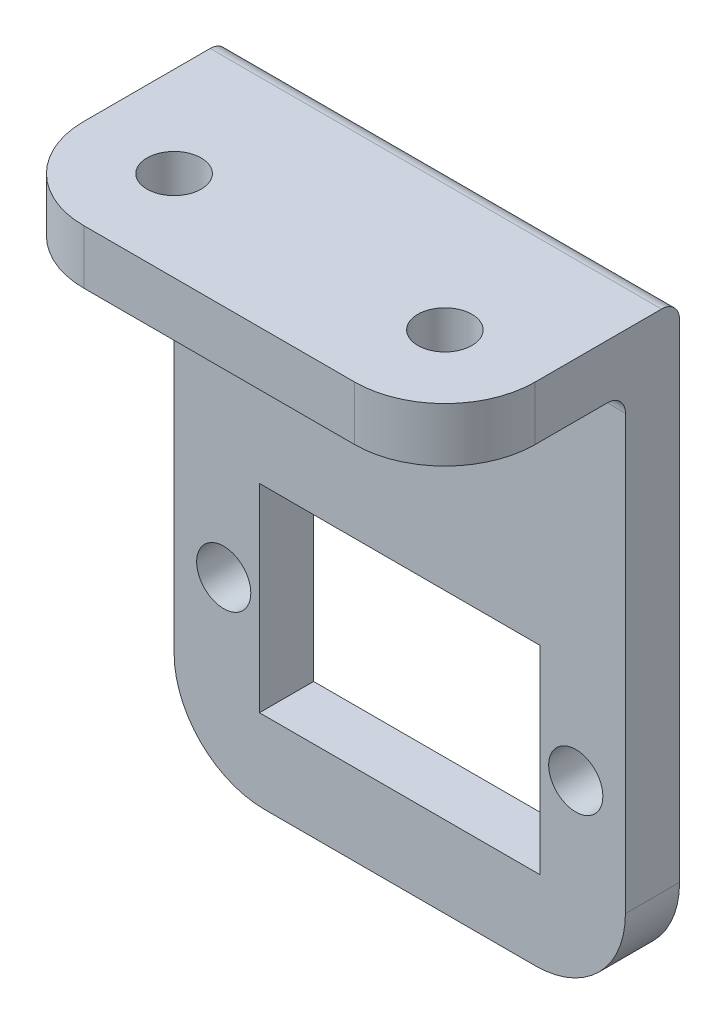
from build123d import *

# Parameters (mm, degrees)
SKETCH1_W           = 25
SKETCH1_H           = 30
SKETCH1_R           = 1.5
BOSS_EXTRUDE1_DEPTH = 3
SKETCH2_W           = 15.54
SKETCH2_H           = 11
CUT_EXTRUDE1_DEPTH  = 20.754746265
FILLET1_R           = 5
SKETCH4_W           = 25
SKETCH4_H           = 3
BOSS_EXTRUDE2_DEPTH = 3
SKETCH5_W           = 25
SKETCH5_H           = 3
BOSS_EXTRUDE3_DEPTH = 10
FILLET2_R           = 5
FILLET3_R           = 5
SKETCH7_R           = 1.5
CUT_EXTRUDE2_DEPTH  = 36.003571246
FILLET4_R           = 1
FILLET5_R           = 1


with BuildPart() as part:
    # Sketch1 → Boss-Extrude1 (new body)
    with BuildSketch(Plane.XY):
        Rectangle(SKETCH1_W, SKETCH1_H)
        with Locations((-9.75, -5)):
            Circle(SKETCH1_R, mode=Mode.SUBTRACT)
        with Locations((9.75, -5)):
            Circle(SKETCH1_R, mode=Mode.SUBTRACT)
    extrude(amount=BOSS_EXTRUDE1_DEPTH)

    # Sketch2 → Cut-Extrude1 (cut, through all)
    with BuildSketch(Plane.XY.offset(3)):
        with Locations((0, -5)):
            Rectangle(SKETCH2_W, SKETCH2_H)
    extrude(amount=-CUT_EXTRUDE1_DEPTH, mode=Mode.SUBTRACT)

    # Fillet1
    fillet1_edges = [part.edges().sort_by_distance(p)[0] for p in [
        (12.5, -15, 1.5),
        (-12.5, -15, 1.5),
    ]]
    fillet(fillet1_edges, radius=FILLET1_R)

    # Sketch4 → Boss-Extrude2 (add)
    with BuildSketch(Plane(origin=(0, 15, 0), x_dir=(1, 0, 0), z_dir=(0, 1, 0))):
        with Locations((0, -1.5)):
            Rectangle(SKETCH4_W, SKETCH4_H)
    extrude(amount=BOSS_EXTRUDE2_DEPTH)

    # Sketch5 → Boss-Extrude3 (add)
    with BuildSketch(Plane.XY.offset(3)):
        with Locations((0, 16.5)):
            Rectangle(SKETCH5_W, SKETCH5_H)
    extrude(amount=BOSS_EXTRUDE3_DEPTH)

    # Fillet2
    fillet2_edges = [part.edges().sort_by_distance(p)[0] for p in [
        (12.5, 16.5, 13),
    ]]
    fillet(fillet2_edges, radius=FILLET2_R)

    # Fillet3
    fillet3_edges = [part.edges().sort_by_distance(p)[0] for p in [
        (-12.5, 16.5, 13),
    ]]
    fillet(fillet3_edges, radius=FILLET3_R)

    # Sketch7 → Cut-Extrude2 (cut, through all)
    with BuildSketch(Plane.XZ.offset(-15)):
        with Locations(Location((-7.5, 8, 0), (0, 0, 270))):
            Circle(SKETCH7_R)
        with Locations(Location((7.5, 8, 0), (0, 0, 270))):
            Circle(SKETCH7_R)
    extrude(amount=-CUT_EXTRUDE2_DEPTH, mode=Mode.SUBTRACT)

    # Fillet4
    fillet4_edges = [part.edges().sort_by_distance(p)[0] for p in [
        (0, 15, 3),
    ]]
    fillet(fillet4_edges, radius=FILLET4_R)

    # Fillet5
    fillet5_edges = [part.edges().sort_by_distance(p)[0] for p in [
        (0, 18, 0),
    ]]
    fillet(fillet5_edges, radius=FILLET5_R)


solid = part.part
